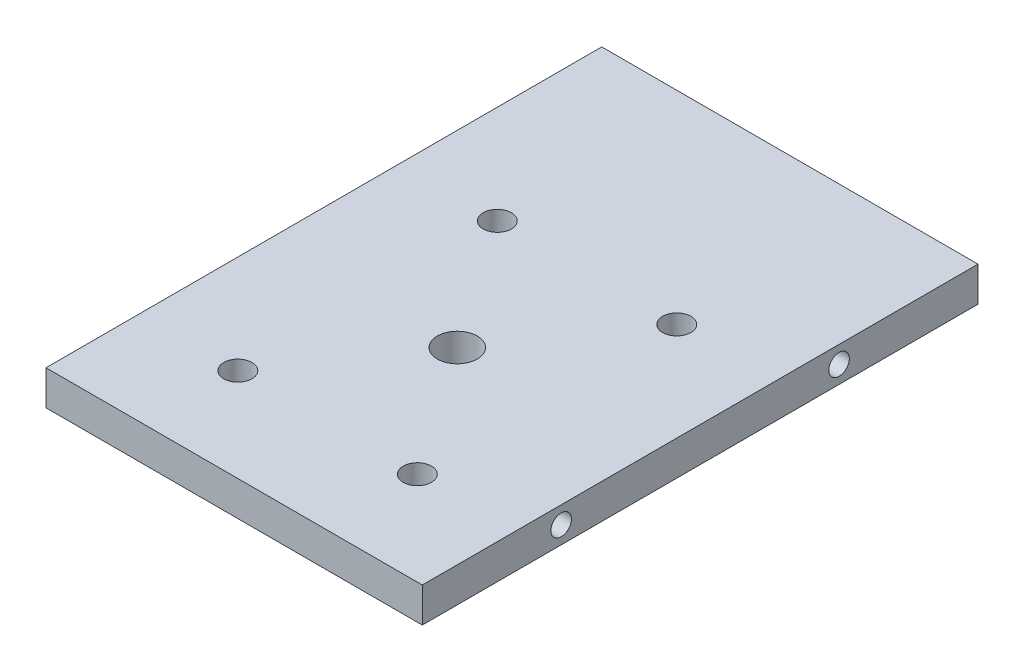
from build123d import *

# Parameters (mm, degrees)
SKETCH1_W                 = 32.5
SKETCH1_H                 = 48
BOSS_EXTRUDE1_DEPTH       = 3
F_2_56_TAPPED_HOLE1_D     = 1.778
F_2_56_TAPPED_HOLE1_DEPTH = 7.46583491
F_2_56_TAPPED_HOLE1_TIP   = 0.53416509
F_2_56_TAPPED_HOLE2_D     = 1.778
F_2_56_TAPPED_HOLE2_DEPTH = 7.46583491
F_2_56_TAPPED_HOLE2_TIP   = 0.53416509
F_8_32_TAPPED_HOLE1_D     = 3.4544
F_8_32_TAPPED_HOLE1_DEPTH = 9.672193539
F_8_32_TAPPED_HOLE1_TIP   = 1.037806461
SKETCH16_R                = 1.22
CUT_EXTRUDE4_DEPTH        = 3


with BuildPart() as part:
    # Sketch1 → Boss-Extrude1 (new body)
    with BuildSketch(Plane(origin=(0, 0, 0), x_dir=(1, 0, 0), z_dir=(0, 1, 0))):
        with Locations((16.25, 24)):
            Rectangle(SKETCH1_W, SKETCH1_H)
    extrude(amount=BOSS_EXTRUDE1_DEPTH)

    # #2-56 Tapped Hole1
    with Locations(Plane.ZY):
        with Locations((-36, 1.5), (-12, 1.5)):
            Hole(F_2_56_TAPPED_HOLE1_D / 2, depth=F_2_56_TAPPED_HOLE1_DEPTH)
            with Locations((0, 0, -(F_2_56_TAPPED_HOLE1_DEPTH + F_2_56_TAPPED_HOLE1_TIP / 2))):  # 118° drill point
                Cone(0, F_2_56_TAPPED_HOLE1_D / 2, F_2_56_TAPPED_HOLE1_TIP, mode=Mode.SUBTRACT)

    # #2-56 Tapped Hole2
    with Locations(Plane(origin=(32.5, 0, 0), x_dir=(0, 0, -1), z_dir=(1, 0, 0))):
        with Locations((12, 1.5), (36, 1.5)):
            Hole(F_2_56_TAPPED_HOLE2_D / 2, depth=F_2_56_TAPPED_HOLE2_DEPTH)
            with Locations((0, 0, -(F_2_56_TAPPED_HOLE2_DEPTH + F_2_56_TAPPED_HOLE2_TIP / 2))):  # 118° drill point
                Cone(0, F_2_56_TAPPED_HOLE2_D / 2, F_2_56_TAPPED_HOLE2_TIP, mode=Mode.SUBTRACT)

    # #8-32 Tapped Hole1
    with Locations(Plane(origin=(0, 3, 0), x_dir=(1, 0, 0), z_dir=(0, 1, 0))):
        with Locations((16.25, 19.275)):
            Hole(F_8_32_TAPPED_HOLE1_D / 2, depth=F_8_32_TAPPED_HOLE1_DEPTH)
            with Locations((0, 0, -(F_8_32_TAPPED_HOLE1_DEPTH + F_8_32_TAPPED_HOLE1_TIP / 2))):  # 118° drill point
                Cone(0, F_8_32_TAPPED_HOLE1_D / 2, F_8_32_TAPPED_HOLE1_TIP, mode=Mode.SUBTRACT)

    # Sketch16 → Cut-Extrude4 (cut)
    with BuildSketch(Plane(origin=(0, 3, 0), x_dir=(1, 0, 0), z_dir=(0, 1, 0))):
        with Locations(Location((8.5, 30.48, 0), (0, 0, 270))):
            Circle(SKETCH16_R)
        with Locations(Location((24, 30.48, 0), (0, 0, 270))):
            Circle(SKETCH16_R)
        with Locations(Location((8.5, 8.07, 0), (0, 0, 270))):
            Circle(SKETCH16_R)
        with Locations(Location((24, 8.07, 0), (0, 0, 270))):
            Circle(SKETCH16_R)
    extrude(amount=-CUT_EXTRUDE4_DEPTH, mode=Mode.SUBTRACT)


solid = part.part
